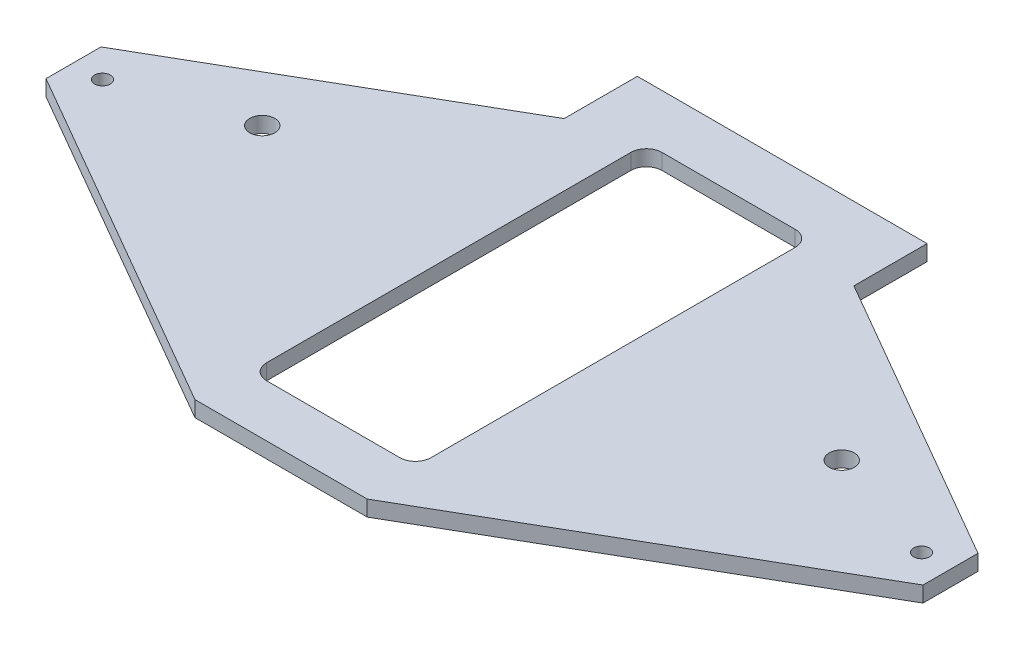
from build123d import *

# Parameters (mm, degrees)
SKETCH4_R           = 1
SKETCH4_R_2         = 1.6
BOSS_EXTRUDE1_DEPTH = 2


with BuildPart() as part:
    # Sketch4 → Boss-Extrude1 (new body)
    with BuildSketch(Plane(origin=(0, 0, 0), x_dir=(1, 0, 0), z_dir=(0, 1, 0))):
        Polygon((-56, -1.6), (-56, -8.619237886), (-11, -34.6), (11, -34.6), (56, -8.619237886), (56, -1.6), (18.5, 20.050635095), (18.5, 29.4), (-18.5, 29.4), (-18.5, 20.050635095), align=None)
        with Locations(Location((-52.3, -5.109618943, 0), (0, 0, 270))):
            Circle(SKETCH4_R, mode=Mode.SUBTRACT)
        with Locations(Location((52.3, -5.109618943, 0), (0, 0, 270))):
            Circle(SKETCH4_R, mode=Mode.SUBTRACT)
        with Locations(Location((37, 0, 0), (0, 0, 270))):
            Circle(SKETCH4_R_2, mode=Mode.SUBTRACT)
        with Locations(Location((-37, 0, 0), (0, 0, 270))):
            Circle(SKETCH4_R_2, mode=Mode.SUBTRACT)
        with BuildLine():
            Line((8.5, -27.944), (-8.5, -27.944))
            ThreePointArc((-8.5, -27.944), (-9.914213562, -27.358213562), (-10.5, -25.944))
            Line((-10.5, -25.944), (-10.5, 20.556))
            ThreePointArc((-10.5, 20.556), (-9.914213562, 21.970213562), (-8.5, 22.556))
            Line((-8.5, 22.556), (8.5, 22.556))
            ThreePointArc((8.5, 22.556), (9.914213562, 21.970213562), (10.5, 20.556))
            Line((10.5, 20.556), (10.5, -25.944))
            ThreePointArc((10.5, -25.944), (9.914213562, -27.358213562), (8.5, -27.944))
        make_face(mode=Mode.SUBTRACT)
    extrude(amount=-BOSS_EXTRUDE1_DEPTH)


solid = part.part
